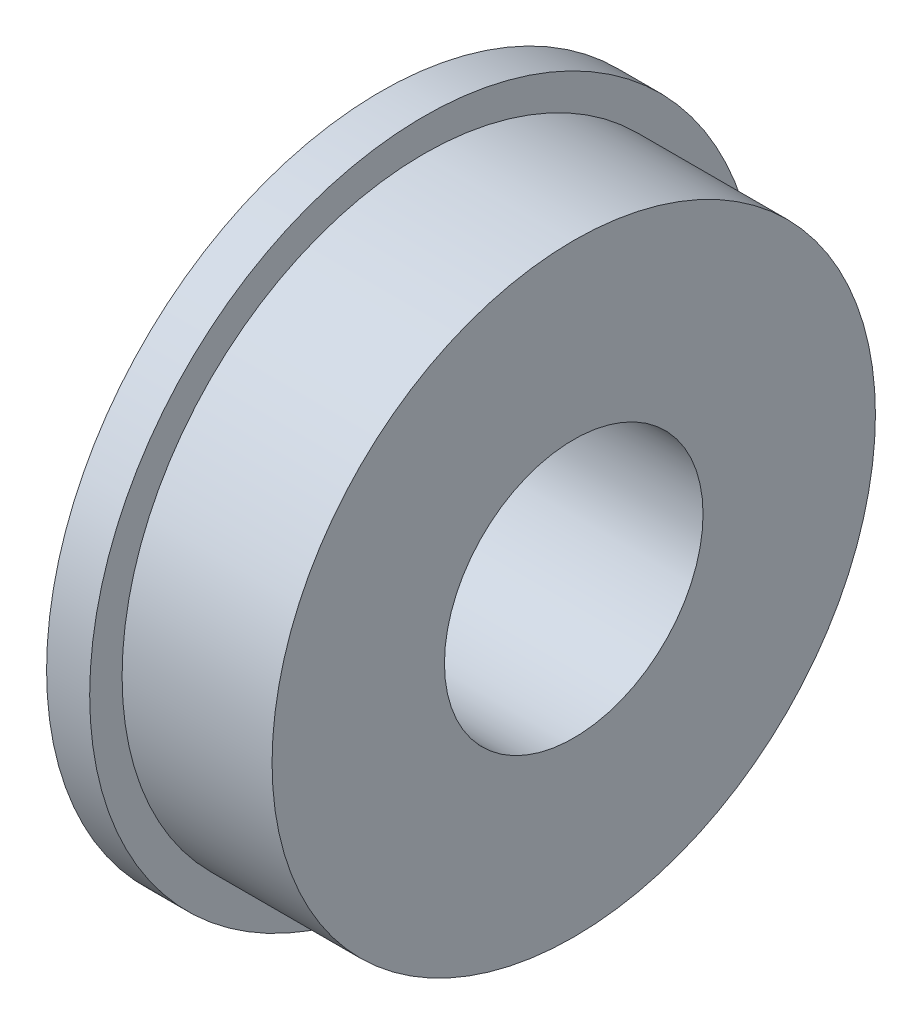
from build123d import *


with BuildPart() as part:
    # Sketch1 → Revolve1 (revolve)
    with BuildSketch(Plane(origin=(0, 0, 0), x_dir=(-1, 0, 0), z_dir=(0, 0, -1)), mode=Mode.PRIVATE) as revolve1_sk:
        Polygon((0, 6.35), (-0.381, 6.35), (-0.381, 9.906), (0, 9.906), (0, 12.3063), (-1.5875, 12.3063), (-1.5875, 11.1125), (-7.112, 11.1125), (-7.112, 4.7625), (0, 4.7625), align=None)
    revolve(revolve1_sk.sketch.rotate(Axis((7.112, 0, 0), (-1, 0, 0)), 270), axis=Axis((7.112, 0, 0), (-1, 0, 0)))


solid = part.part
